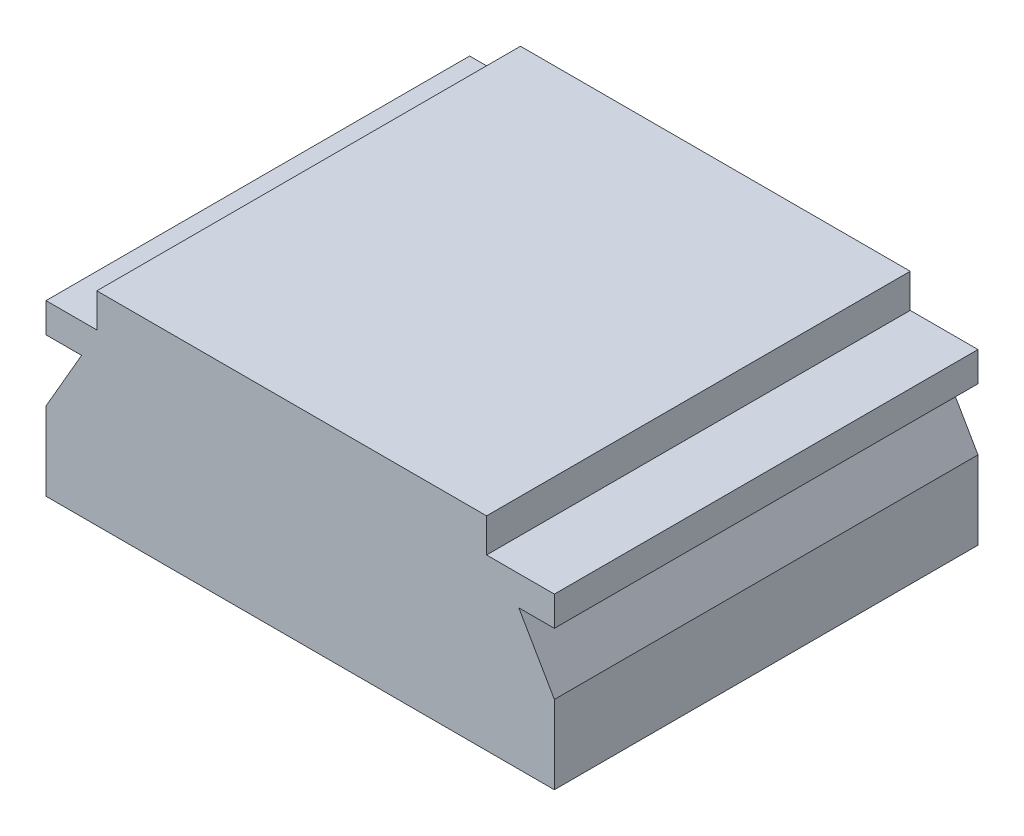
from build123d import *

# Parameters (mm, degrees)
SKETCH_1_W          = 12.4
SKETCH_1_H          = 5
EXTRUDE_1_DEPTH     = 10
SKETCH_2_W          = 1.2
SKETCH_2_H          = 0.6
SKETCH_2_W_2        = 1.6
CUT_EXTRUDE_1_DEPTH = 10


with BuildPart() as part:
    # 草图1 → 凸台-拉伸1 (new body)
    with BuildSketch(Plane.XY):
        Rectangle(SKETCH_1_W, SKETCH_1_H)
    extrude(amount=EXTRUDE_1_DEPTH)

    # 草图2 → 切除-拉伸1 (cut)
    with BuildSketch(Plane(origin=(0, 0, 0), x_dir=(-1, 0, 0), z_dir=(0, 0, -1))):
        with Locations((5.6, 2.2)):
            Rectangle(SKETCH_2_W, SKETCH_2_H)
        Polygon((5, 2.5), (4.8, 2.5), (4.8, 1.7), (6, 1.7), (6, 1), (5.160769515, 1), (6, -0.453589838), (6, -2.3), (-6, -2.3), (-6, -0.453589838), (-5.160769515, 1), (-6, 1), (-6, 1.7), (-4.4, 1.7), (-4.4, 2.5), (-4.6, 2.5), (-4.6, 1.9), (-6.2, 1.9), (-6.2, 0.8), (-5.507179677, 0.8), (-6.2, -0.4), (-6.2, -2.5), (6.2, -2.5), (6.2, -0.4), (5.507179677, 0.8), (6.2, 0.8), (6.2, 1.9), (5, 1.9), align=None)
        Polygon((6.2, -0.4), (6.2, 0.8), (5.507179677, 0.8), align=None)
        Polygon((-5.507179677, 0.8), (-6.2, 0.8), (-6.2, -0.4), align=None)
        with Locations((-5.4, 2.2)):
            Rectangle(SKETCH_2_W_2, SKETCH_2_H)
    extrude(amount=-CUT_EXTRUDE_1_DEPTH, mode=Mode.SUBTRACT)


solid = part.part
